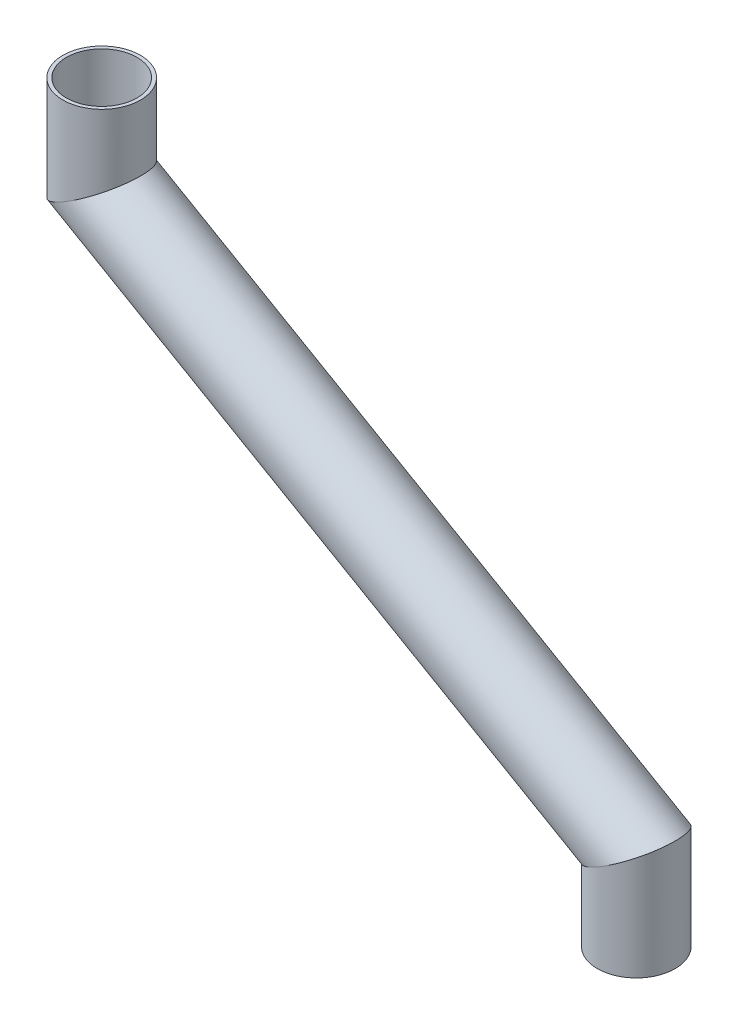
from build123d import *

# Parameters (mm, degrees)
SKETCH2_R   = 22
SKETCH2_R_2 = 20


with BuildPart() as part:
    # Sweep1: sweep along a path in Sketch1
    with BuildLine(Plane.XY) as sweep1_path:
        Line((0, 57.605467438), (0, 7.605467438))
        Line((0, 7.605467438), (303.108891325, -167.394532562))
        Line((303.108891325, -167.394532562), (303.108891325, -217.394532562))
    # Sketch2 → Sweep1 (sweep)
    with BuildSketch(Plane(origin=(0, 50, 0), x_dir=(1, 0, 0), z_dir=(0, 1, 0))):
        Circle(SKETCH2_R)
        Circle(SKETCH2_R_2, mode=Mode.SUBTRACT)
    sweep(path=sweep1_path.line, transition=Transition.RIGHT)


solid = part.part
